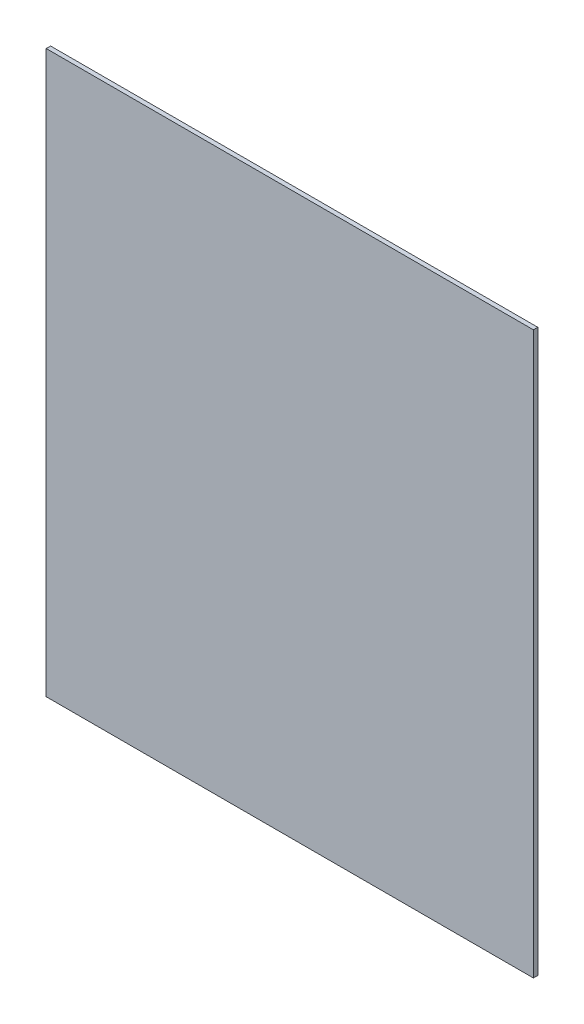
from build123d import *

# Parameters (mm, degrees)
ESQUISSE1_W        = 722
ESQUISSE1_H        = 832
BOSS_EXTRU_1_DEPTH = 6.5


with BuildPart() as part:
    # Esquisse1 → Boss.-Extru.1 (new body)
    with BuildSketch(Plane.XY):
        Rectangle(ESQUISSE1_W, ESQUISSE1_H)
    extrude(amount=BOSS_EXTRU_1_DEPTH)


solid = part.part
